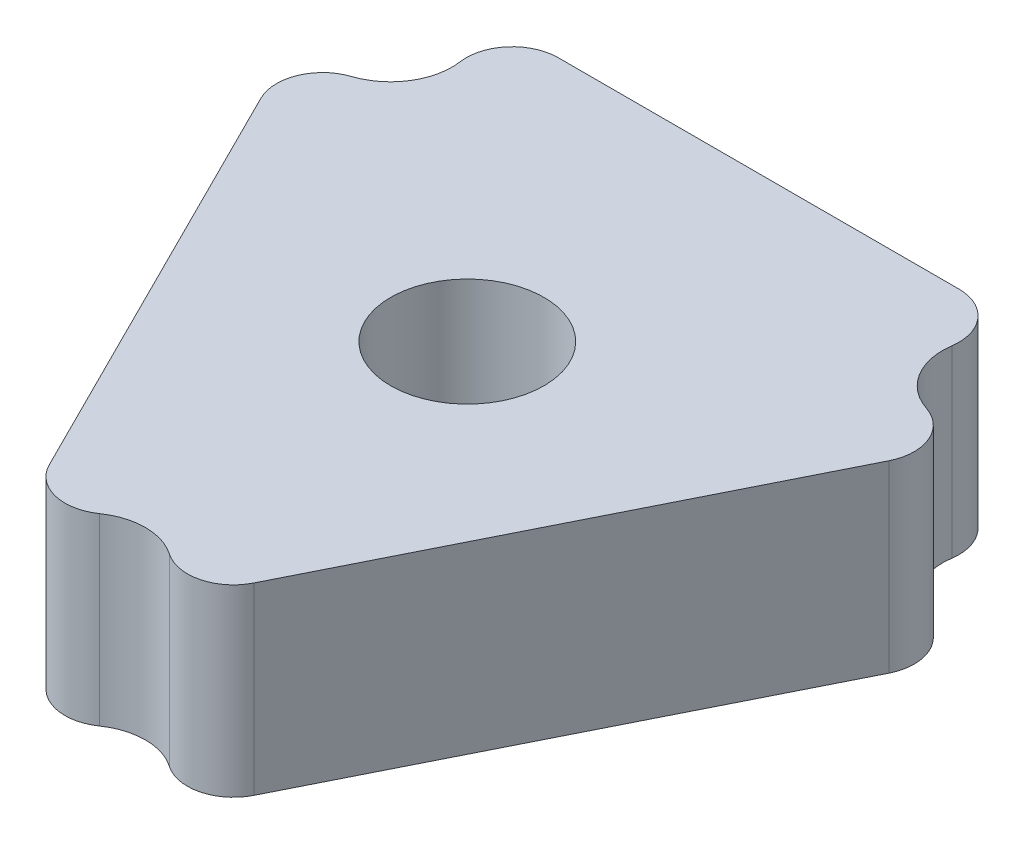
from build123d import *

# Parameters (mm, degrees)
SKETCH1_R           = 5
BOSS_EXTRUDE1_DEPTH = 12


with BuildPart() as part:
    # Sketch1 → Boss-Extrude1 (new body)
    with BuildSketch(Plane(origin=(0, 0, 0), x_dir=(1, 0, 0), z_dir=(0, 1, 0))):
        with BuildLine():
            Line((-20.479322087, 7.014372264), (-6.676095441, -20.592081028))
            ThreePointArc((-6.676095441, -20.592081028), (-4.735248894, -22.157120519), (-2.281607925, -21.714537281))
            ThreePointArc((-2.281607925, -21.714537281), (0, -21), (2.281607925, -21.714537281))
            ThreePointArc((2.281607925, -21.714537281), (4.735248894, -22.157120519), (6.676095441, -20.592081028))
            Line((6.676095441, -20.592081028), (20.479322087, 7.014372264))
            ThreePointArc((20.479322087, 7.014372264), (20.566845751, 9.506073196), (18.740594579, 11.203436029))
            ThreePointArc((18.740594579, 11.203436029), (16.597396767, 12.897075552), (16.041026726, 15.571428571))
            ThreePointArc((16.041026726, 15.571428571), (15.339583608, 17.963961012), (13.07179677, 19))
            Line((13.07179677, 19), (-13.07179677, 19))
            ThreePointArc((-13.07179677, 19), (-15.339583608, 17.963961012), (-16.041026726, 15.571428571))
            ThreePointArc((-16.041026726, 15.571428571), (-16.597396767, 12.897075552), (-18.740594579, 11.203436029))
            ThreePointArc((-18.740594579, 11.203436029), (-20.566845751, 9.506073196), (-20.479322087, 7.014372264))
        make_face()
        with Locations(Location((0, 0, 0), (0, 0, 270))):
            Circle(SKETCH1_R, mode=Mode.SUBTRACT)
    extrude(amount=BOSS_EXTRUDE1_DEPTH)


solid = part.part
